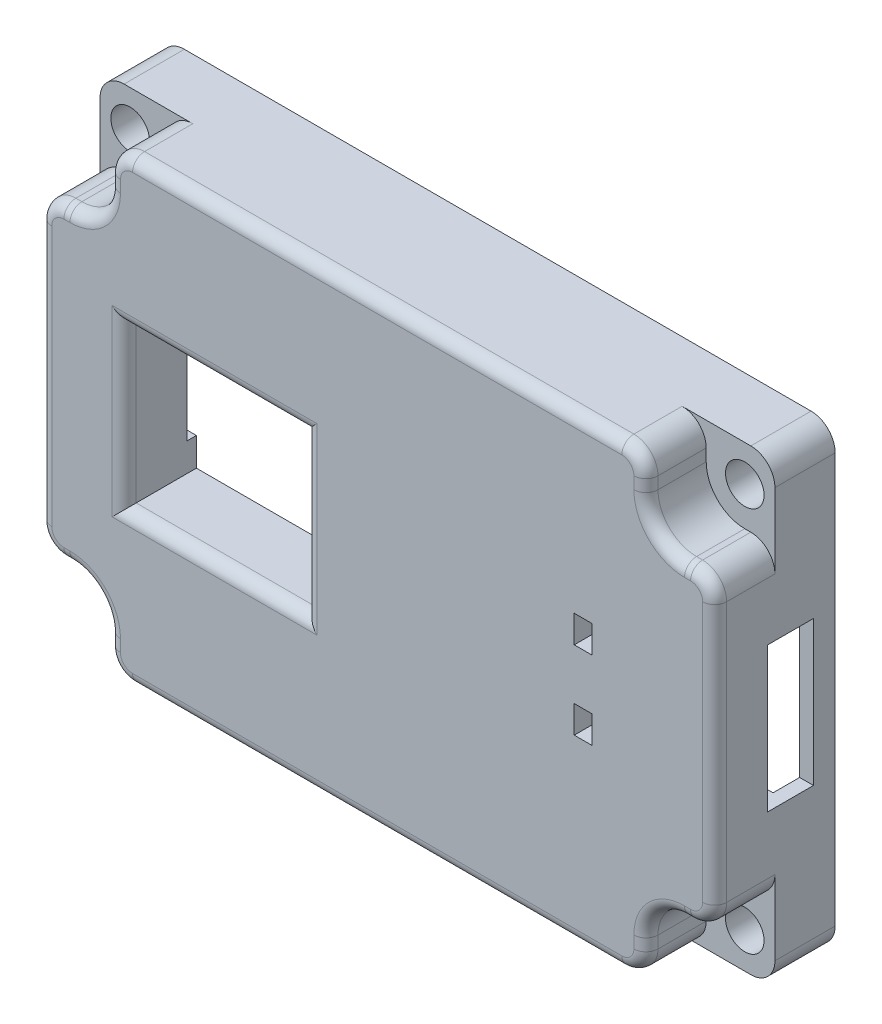
from build123d import *

# Parameters (mm, degrees)
SKETCH_1_W          = 56
SKETCH_1_H          = 38
EXTRUDE_1_DEPTH     = 10
SKETCH_2_W          = 15
SKETCH_2_H          = 13.2
SKETCH_2_W_2        = 1.48
SKETCH_2_H_2        = 2.27
CUT_EXTRUDE_1_DEPTH = 8
SKETCH_3_W          = 53.7
SKETCH_3_H          = 22.7
CUT_EXTRUDE_2_DEPTH = 2
CUT_EXTRUDE_4_REACH = 61.975
SKETCH_5_W          = 3.2
SKETCH_5_H          = 8.5
CUT_EXTRUDE_5_REACH = 61.975
SKETCH_6_W          = 3.8
SKETCH_6_H          = 12
SKETCH_7_R          = 1.6
CUT_EXTRUDE_6_DEPTH = 36.284557529
FILLET_1_R          = 2
CUT_EXTRUDE_7_DEPTH = 5
FILLET_3_R          = 2
FILLET_4_R          = 1
SKETCH_10_W         = 53.7
SKETCH_10_H         = 18
CUT_EXTRUDE_9_DEPTH = 4


with BuildPart() as part:
    # 草图1 → 凸台-拉伸1 (new body)
    with BuildSketch(Plane.XY):
        Rectangle(SKETCH_1_W, SKETCH_1_H)
    extrude(amount=EXTRUDE_1_DEPTH)

    # 草图2 → 切除-拉伸1 (cut)
    with BuildSketch(Plane.XY.offset(10)):
        with Locations((-13.5, 0)):
            Rectangle(SKETCH_2_W, SKETCH_2_H)
        with Locations((17.09, 3.515)):
            Rectangle(SKETCH_2_W_2, SKETCH_2_H_2)
        with Locations((17.09, -2.975)):
            Rectangle(SKETCH_2_W_2, SKETCH_2_H_2)
    extrude(amount=-CUT_EXTRUDE_1_DEPTH, mode=Mode.SUBTRACT)

    # 草图3 → 切除-拉伸2 (cut)
    with BuildSketch(Plane(origin=(0, 0, 0), x_dir=(-1, 0, 0), z_dir=(0, 0, -1))):
        Rectangle(SKETCH_3_W, SKETCH_3_H)
    extrude(amount=-CUT_EXTRUDE_2_DEPTH, mode=Mode.SUBTRACT)

    # 草图5 → 切除-拉伸4 (cut, up to next)
    with BuildSketch(Plane.ZY.offset(28), mode=Mode.PRIVATE) as cut_extrude_4_sk1:
        with Locations((3.18, 0)):
            Rectangle(SKETCH_5_W, SKETCH_5_H)
    cut_extrude_4_tool1 = extrude(cut_extrude_4_sk1.sketch, amount=-CUT_EXTRUDE_4_REACH, mode=Mode.PRIVATE) & part.part
    add(cut_extrude_4_tool1.solids().sort_by_distance((-28, 0, 3.18))[0], mode=Mode.SUBTRACT)

    # 草图6 → 切除-拉伸5 (cut, up to next)
    with BuildSketch(Plane(origin=(28, 0, 0), x_dir=(0, 0, -1), z_dir=(1, 0, 0)), mode=Mode.PRIVATE) as cut_extrude_5_sk1:
        with Locations((-3.7, 0)):
            Rectangle(SKETCH_6_W, SKETCH_6_H)
    cut_extrude_5_tool1 = extrude(cut_extrude_5_sk1.sketch, amount=-CUT_EXTRUDE_5_REACH, mode=Mode.PRIVATE) & part.part
    add(cut_extrude_5_tool1.solids().sort_by_distance((28, 0, 3.7))[0], mode=Mode.SUBTRACT)

    # 草图7 → 切除-拉伸6 (cut, through all)
    with BuildSketch(Plane(origin=(0, 0, 0), x_dir=(-1, 0, 0), z_dir=(0, 0, -1))):
        with Locations((25.5, 16)):
            Circle(SKETCH_7_R)
        with Locations(Location((25.5, -16, 0), (0, 0, 180))):
            Circle(SKETCH_7_R)
        with Locations((-25.5, -16)):
            Circle(SKETCH_7_R)
        with Locations(Location((-25.5, 16, 0), (0, 0, 180))):
            Circle(SKETCH_7_R)
    extrude(amount=-CUT_EXTRUDE_6_DEPTH, mode=Mode.SUBTRACT)

    # 圆角1
    fillet_1_edges = [part.edges().sort_by_distance(p)[0] for p in [
        (28, -19, 5),
        (-28, -19, 5),
        (-28, 19, 5),
        (28, 19, 5),
    ]]
    fillet(fillet_1_edges, radius=FILLET_1_R)

    # 草图8 → 切除-拉伸7 (cut)
    with BuildSketch(Plane.XY.offset(10)):
        with BuildLine():
            Line((-22.3, 16), (-22.3, 19))
            Line((-22.3, 19), (-26, 19))
            ThreePointArc((-26, 19), (-27.414213562, 18.414213562), (-28, 17))
            Line((-28, 17), (-28, 12.8))
            Line((-28, 12.8), (-25.5, 12.8))
            ThreePointArc((-25.5, 12.8), (-23.2372583, 13.7372583), (-22.3, 16))
        make_face()
        with BuildLine():
            Line((28, 12.8), (28, 17))
            ThreePointArc((28, 17), (27.414213562, 18.414213562), (26, 19))
            Line((26, 19), (22.3, 19))
            Line((22.3, 19), (22.3, 16))
            ThreePointArc((22.3, 16), (23.2372583, 13.7372583), (25.5, 12.8))
            Line((25.5, 12.8), (28, 12.8))
        make_face()
        with BuildLine():
            Line((-28, -12.8), (-28, -17))
            ThreePointArc((-28, -17), (-27.414213562, -18.414213562), (-26, -19))
            Line((-26, -19), (-22.3, -19))
            Line((-22.3, -19), (-22.3, -16))
            ThreePointArc((-22.3, -16), (-23.2372583, -13.7372583), (-25.5, -12.8))
            Line((-25.5, -12.8), (-28, -12.8))
        make_face()
        with BuildLine():
            Line((26, -19), (22.3, -19))
            Line((22.3, -19), (22.3, -16))
            ThreePointArc((22.3, -16), (23.2372583, -13.7372583), (25.5, -12.8))
            Line((25.5, -12.8), (28, -12.8))
            Line((28, -12.8), (28, -17))
            ThreePointArc((28, -17), (27.414213562, -18.414213562), (26, -19))
        make_face()
    extrude(amount=-CUT_EXTRUDE_7_DEPTH, mode=Mode.SUBTRACT)

    # 圆角3
    fillet_3_edges = [part.edges().sort_by_distance(p)[0] for p in [
        (28, 12.8, 7.5),
        (22.3, 19, 7.5),
        (-28, -12.8, 7.5),
        (-22.3, -19, 7.5),
        (22.3, -19, 7.5),
        (28, -12.8, 7.5),
        (-28, 12.8, 7.5),
        (-22.3, 19, 7.5),
    ]]
    fillet(fillet_3_edges, radius=FILLET_3_R)

    # 圆角4
    fillet_4_edges = [part.edges().sort_by_distance(p)[0] for p in [
        (23.2372583, 13.7372583, 10),
        (25.75, 12.8, 10),
        (-23.2372583, -13.7372583, 10),
        (-25.75, -12.8, 10),
        (-6, 0, 10),
        (23.2372583, -13.7372583, 10),
        (-13.5, 6.6, 10),
        (22.3, -16.5, 10),
        (-21, 0, 10),
        (-13.5, -6.6, 10),
        (-23.2372583, 13.7372583, 10),
        (-22.3, 16.5, 10),
        (0, -19, 10),
        (28, 0, 10),
        (22.3, 16.5, 10),
        (0, 19, 10),
        (-25.75, 12.8, 10),
        (-28, 0, 10),
        (-22.3, -16.5, 10),
        (25.75, -12.8, 10),
        (-27.414213562, -12.214213562, 10),
        (-21.714213562, -18.414213562, 10),
        (-27.414213562, 12.214213562, 10),
        (-21.714213562, 18.414213562, 10),
        (27.414213562, 12.214213562, 10),
        (21.714213562, 18.414213562, 10),
        (27.414213562, -12.214213562, 10),
        (21.714213562, -18.414213562, 10),
    ]]
    fillet(fillet_4_edges, radius=FILLET_4_R)

    # 草图10 → 切除-拉伸9 (cut)
    with BuildSketch(Plane(origin=(0, 0, 0), x_dir=(-1, 0, 0), z_dir=(0, 0, -1))):
        Rectangle(SKETCH_10_W, SKETCH_10_H)
    extrude(amount=-CUT_EXTRUDE_9_DEPTH, mode=Mode.SUBTRACT)


solid = part.part
